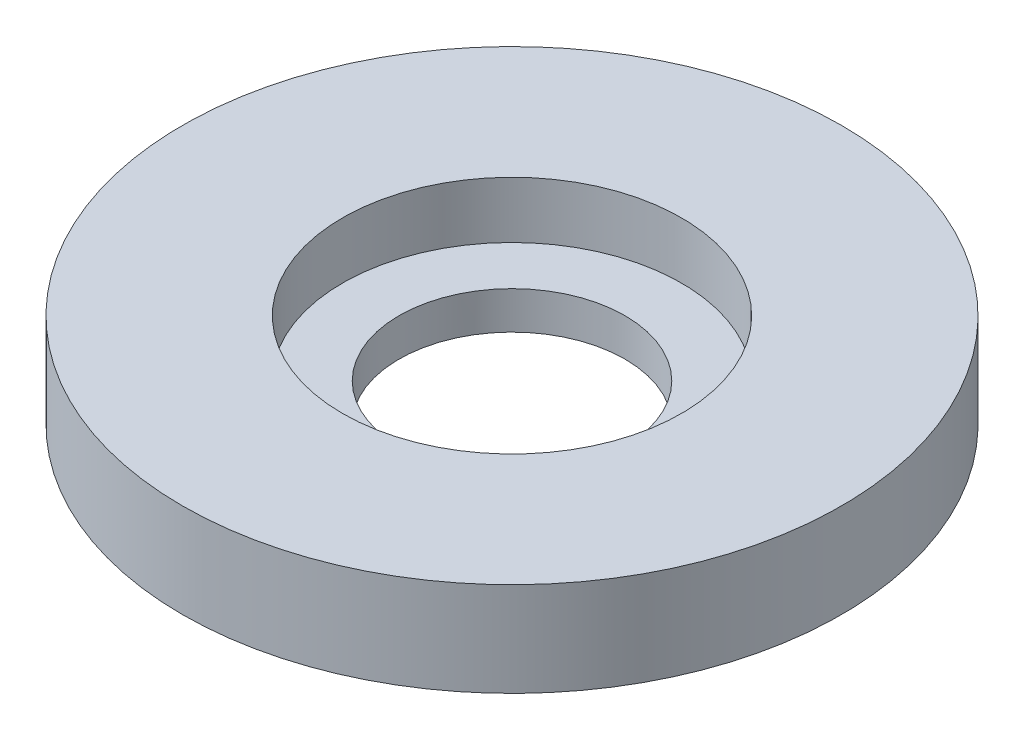
from build123d import *

# Parameters (mm, degrees)
SKETCH1_R           = 1750
BOSS_EXTRUDE1_DEPTH = 500
SKETCH2_R           = 900
CUT_EXTRUDE2_DEPTH  = 300
SKETCH3_R           = 600
CUT_EXTRUDE3_DEPTH  = 300


with BuildPart() as part:
    # Sketch1 → Boss-Extrude1 (new body)
    with BuildSketch(Plane(origin=(0, 0, 0), x_dir=(1, 0, 0), z_dir=(0, 1, 0))):
        with Locations(Location((0, 0, 0), (0, 0, 270))):
            Circle(SKETCH1_R)
    extrude(amount=BOSS_EXTRUDE1_DEPTH)

    # Sketch2 → Cut-Extrude2 (cut)
    with BuildSketch(Plane(origin=(0, 500, 0), x_dir=(1, 0, 0), z_dir=(0, 1, 0))):
        with Locations(Location((0, 0, 0), (0, 0, 270))):
            Circle(SKETCH2_R)
    extrude(amount=-CUT_EXTRUDE2_DEPTH, mode=Mode.SUBTRACT)

    # Sketch3 → Cut-Extrude3 (cut)
    with BuildSketch(Plane.XZ):
        with Locations(Location((0, 0, 0), (0, 0, 270))):
            Circle(SKETCH3_R)
    extrude(amount=-CUT_EXTRUDE3_DEPTH, mode=Mode.SUBTRACT)


solid = part.part
